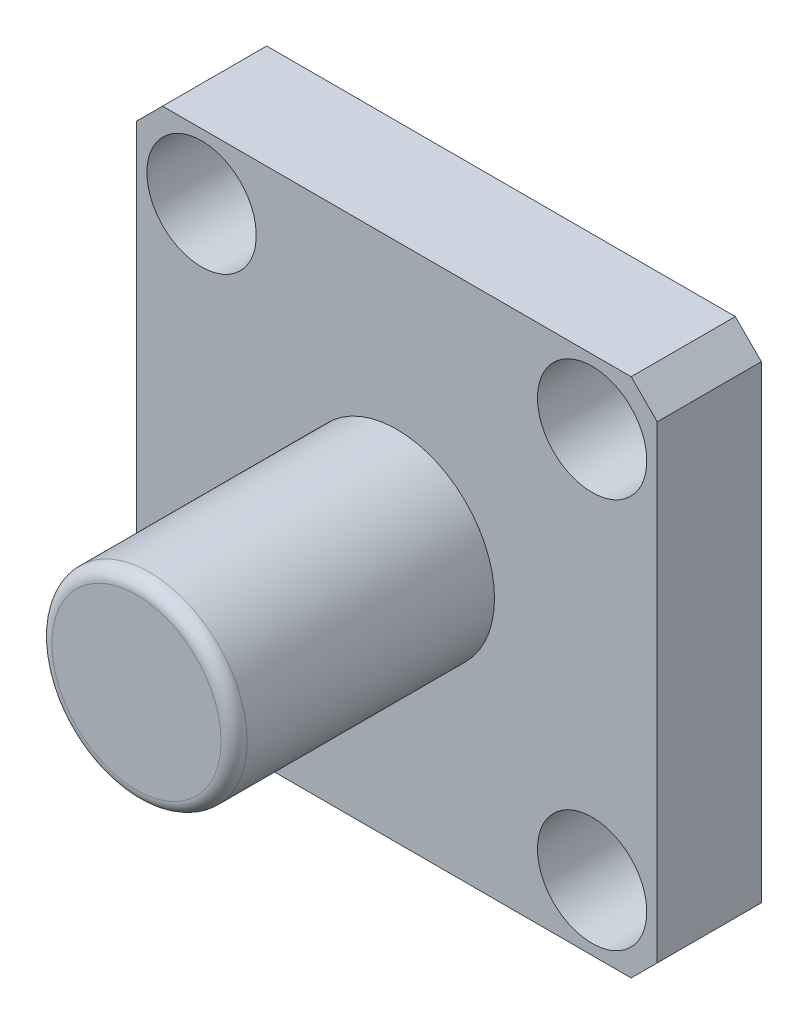
from build123d import *

# Parameters (mm, degrees)
SKETCH_1_W                        = 20
SKETCH_1_H                        = 20
EXTRUDE_1_DEPTH                   = 4
SKETCH_2_R                        = 3.75
EXTRUDE_2_DEPTH                   = 10
HOLE_WIZARD_4_2_4_2_1_D           = 4.2
HOLE_WIZARD_4_2_4_2_1_CSINK_D     = 4.25
HOLE_WIZARD_4_2_4_2_1_CSINK_ANGLE = 90
FILLET_1_R                        = 0.5
CHAMFER_1_SIZE                    = 1


with BuildPart() as part:
    # 草图1 → 凸台-拉伸1 (new body)
    with BuildSketch(Plane.XY):
        Rectangle(SKETCH_1_W, SKETCH_1_H)
    extrude(amount=EXTRUDE_1_DEPTH)

    # 草图2 → 凸台-拉伸2 (add)
    with BuildSketch(Plane.XY.offset(4)):
        Circle(SKETCH_2_R)
    extrude(amount=EXTRUDE_2_DEPTH)

    # Ø4.2 (4.2) 直径孔1 (through all)
    with Locations(Plane(origin=(7.5, 7.5, 0), x_dir=(-1, 0, 0), z_dir=(0, 0, -1))):
        with Locations((0, 0), (15, 0), (15, -15), (0, -15)):
            CounterSinkHole(HOLE_WIZARD_4_2_4_2_1_D / 2, HOLE_WIZARD_4_2_4_2_1_CSINK_D / 2, counter_sink_angle=HOLE_WIZARD_4_2_4_2_1_CSINK_ANGLE)

    # 圆角1
    fillet_1_edges = [part.edges().sort_by_distance(p)[0] for p in [
        (-3.75, 0, 14),
    ]]
    fillet(fillet_1_edges, radius=FILLET_1_R)

    # 倒角1
    chamfer_1_edges = [part.edges().sort_by_distance(p)[0] for p in [
        (10, -10, 2),
        (-10, -10, 2),
        (-10, 10, 2),
        (10, 10, 2),
    ]]
    chamfer(chamfer_1_edges, length=CHAMFER_1_SIZE)


solid = part.part
